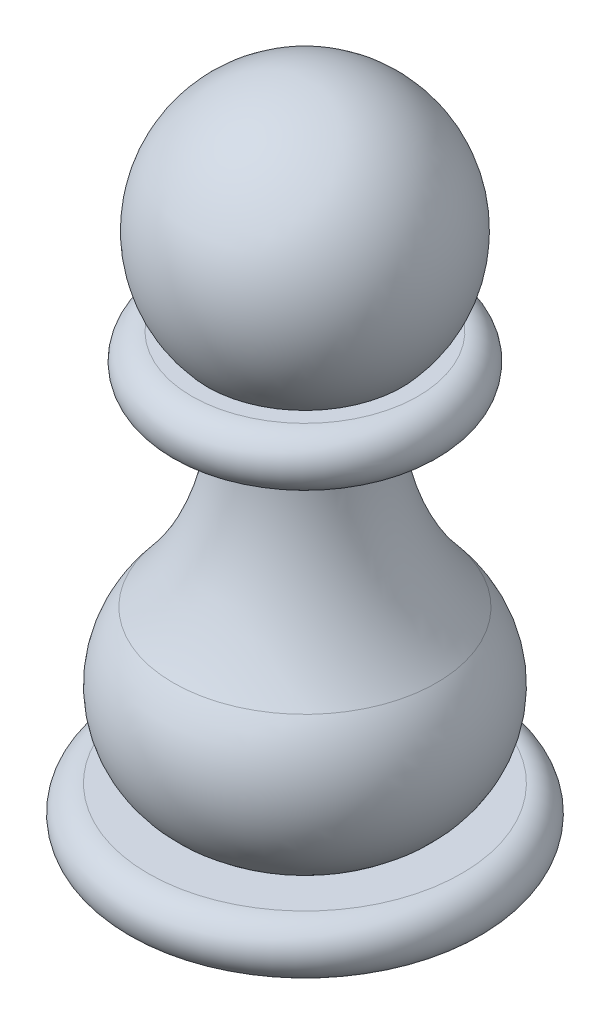
from build123d import *


with BuildPart() as part:
    # Sketch2 → Revolve1 (revolve)
    with BuildSketch(Plane(origin=(0, 0, 0), x_dir=(0, 0, -1), z_dir=(1, 0, 0)), mode=Mode.PRIVATE) as revolve1_sk:
        with BuildLine():
            Line((0, 0), (0, -38))
            Line((0, -38), (9, -38))
            ThreePointArc((9, -38), (10.5, -36.5), (9, -35))
            Line((9, -35), (6.5, -35))
            ThreePointArc((6.5, -35), (8.956479045, -30.847960847), (7.562140976, -26.229569377))
            ThreePointArc((7.562140976, -26.229569377), (4.731529648, -21.213224807), (4, -15.5))
            Line((4, -15.5), (6.5, -15.5))
            ThreePointArc((6.5, -15.5), (8, -14), (6.5, -12.5))
            Line((6.5, -12.5), (5.590169944, -12.5))
            ThreePointArc((5.590169944, -12.5), (6.846531969, -4.438137822), (0, 0))
        make_face()
    revolve(revolve1_sk.sketch.rotate(Axis((0, 0, 0), (0, -1, 0)), 180), axis=Axis((0, 0, 0), (0, -1, 0)))


solid = part.part
